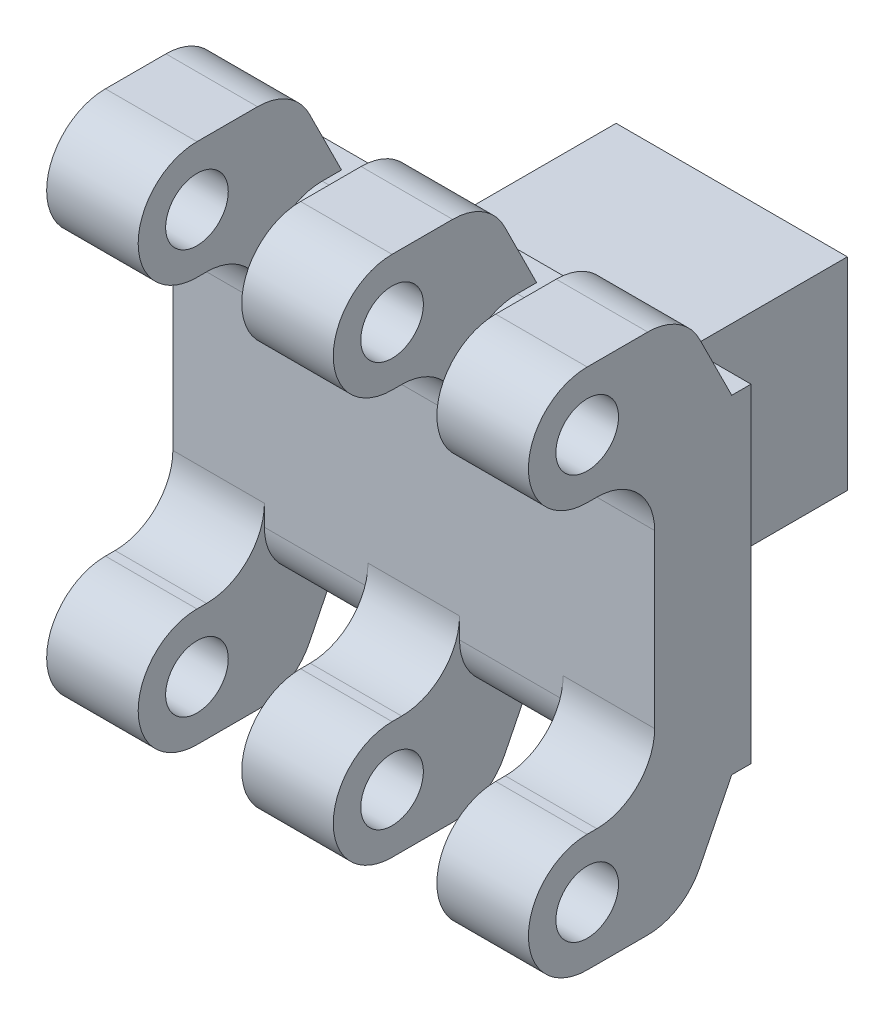
from build123d import *

# Parameters (mm, degrees)
SKETCH1_W               = 50
SKETCH1_H               = 34.11
BOSS_EXTRUDE1_DEPTH     = 10
SKETCH3_W               = 41
SKETCH3_H               = 21
BOSS_EXTRUDE2_DEPTH     = 3
CUT_EXTRUDE1_DEPTH      = 32.872763059
CUT_EXTRUDE1_DEPTH_BACK = 7
SKETCH2_W               = 3.5
SKETCH2_H               = 31
SKETCH4_W               = 25
SKETCH4_H               = 21
BOSS_EXTRUDE3_DEPTH     = 20
SKETCH5_R               = 8.6
CUT_EXTRUDE2_DEPTH      = 30
SKETCH6_R               = 3.25
BOSS_EXTRUDE4_DEPTH     = 9.5
LPATTERN1_COUNT         = 3
LPATTERN1_PITCH         = 20.25
MIRROR1_COPY_1_SKETCH_R = 3.25
MIRROR1_COPY_1_DEPTH    = 9.5
MIRROR1_COPY_2_SKETCH_R = 3.25
MIRROR1_COPY_2_DEPTH    = 9.5
FILLET1_R               = 6
SKETCH7_W               = 23
SKETCH7_H               = 21
CUT_EXTRUDE3_DEPTH      = 0.5
FILLET2_R               = 6


with BuildPart() as part:
    # Sketch1 → Boss-Extrude1 (new body)
    with BuildSketch(Plane.XY):
        Rectangle(SKETCH1_W, SKETCH1_H)
    extrude(amount=BOSS_EXTRUDE1_DEPTH)

    # Sketch3 → Boss-Extrude2 (add)
    with BuildSketch(Plane(origin=(0, 0, 0), x_dir=(-1, 0, 0), z_dir=(0, 0, -1))):
        Rectangle(SKETCH3_W, SKETCH3_H)
    extrude(amount=BOSS_EXTRUDE2_DEPTH)

    # Sketch2 → Cut-Extrude1 (cut, two sides: drawn at the far end of the back side and taken through both)
    with BuildSketch(Plane(origin=(0, 0, 0), x_dir=(-1, 0, 0), z_dir=(0, 0, -1)).offset(-CUT_EXTRUDE1_DEPTH_BACK)):
        with Locations((-14.25, 0)):
            Rectangle(SKETCH2_W, SKETCH2_H)
        with Locations((14.25, 0)):
            Rectangle(SKETCH2_W, SKETCH2_H)
    extrude(amount=CUT_EXTRUDE1_DEPTH + CUT_EXTRUDE1_DEPTH_BACK, mode=Mode.SUBTRACT)

    # Sketch4 → Boss-Extrude3 (add)
    with BuildSketch(Plane(origin=(0, 0, -3), x_dir=(-1, 0, 0), z_dir=(0, 0, -1))):
        Rectangle(SKETCH4_W, SKETCH4_H)
    extrude(amount=BOSS_EXTRUDE3_DEPTH)

    # Sketch5 → Cut-Extrude2 (cut)
    with BuildSketch(Plane(origin=(0, 0, -23), x_dir=(-1, 0, 0), z_dir=(0, 0, -1))):
        Circle(SKETCH5_R)
    extrude(amount=-CUT_EXTRUDE2_DEPTH, mode=Mode.SUBTRACT)

    # Sketch6 → Boss-Extrude4 (add)
    with BuildSketch(Plane(origin=(25, 0, 0), x_dir=(0, 0, -1), z_dir=(1, 0, 0))):
        with BuildLine():
            Line((-17, 27.1), (-7, 27.1))
            Line((-7, 27.1), (-2, 17.055))
            Line((-2, 17.055), (-10, 17.055))
            Line((-10, 17.055), (-10, 14.9))
            Line((-10, 14.9), (-17, 14.9))
            ThreePointArc((-17, 14.9), (-23.1, 21), (-17, 27.1))
        make_face()
        with Locations((-17, 21)):
            Circle(SKETCH6_R, mode=Mode.SUBTRACT)
    boss_extrude4 = extrude(amount=-BOSS_EXTRUDE4_DEPTH)

    # LPattern1: Boss-Extrude4 ×3
    with Locations(*[(-i * LPATTERN1_PITCH, 0, 0) for i in range(1, LPATTERN1_COUNT)]):
        add(boss_extrude4)

    # Mirror1: Boss-Extrude4 across plane
    add(boss_extrude4.mirror(Plane.ZX))

    # Mirror1 copy 1 sketch → Mirror1 copy 1 (add)
    with BuildSketch(Plane(origin=(4.75, 0, 0), x_dir=(0, 0, -1), z_dir=(1, 0, 0))):
        with BuildLine():
            Line((-17, -27.1), (-7, -27.1))
            Line((-7, -27.1), (-2, -17.055))
            Line((-2, -17.055), (-10, -17.055))
            Line((-10, -17.055), (-10, -14.9))
            Line((-10, -14.9), (-17, -14.9))
            ThreePointArc((-17, -14.9), (-23.1, -21), (-17, -27.1))
        make_face()
        with Locations((-17, -21)):
            Circle(MIRROR1_COPY_1_SKETCH_R, mode=Mode.SUBTRACT)
    extrude(amount=-MIRROR1_COPY_1_DEPTH)

    # Mirror1 copy 2 sketch → Mirror1 copy 2 (add)
    with BuildSketch(Plane(origin=(-15.5, 0, 0), x_dir=(0, 0, -1), z_dir=(1, 0, 0))):
        with BuildLine():
            Line((-17, -27.1), (-7, -27.1))
            Line((-7, -27.1), (-2, -17.055))
            Line((-2, -17.055), (-10, -17.055))
            Line((-10, -17.055), (-10, -14.9))
            Line((-10, -14.9), (-17, -14.9))
            ThreePointArc((-17, -14.9), (-23.1, -21), (-17, -27.1))
        make_face()
        with Locations((-17, -21)):
            Circle(MIRROR1_COPY_2_SKETCH_R, mode=Mode.SUBTRACT)
    extrude(amount=-MIRROR1_COPY_2_DEPTH)

    # Fillet1
    fillet1_edges = [part.edges().sort_by_distance(p)[0] for p in [
        (20.25, 27.1, 7),
        (20.25, 14.9, 10),
        (0, 27.1, 7),
        (0, 14.9, 10),
        (-20.25, 27.1, 7),
        (-20.25, 14.9, 10),
        (20.25, -14.9, 10),
        (20.25, -27.1, 7),
        (0, -14.9, 10),
        (0, -27.1, 7),
        (-20.25, -14.9, 10),
        (-20.25, -27.1, 7),
    ]]
    fillet(fillet1_edges, radius=FILLET1_R)

    # Sketch7 → Cut-Extrude3 (cut)
    with BuildSketch(Plane(origin=(12.5, 0, 0), x_dir=(0, 0, -1), z_dir=(1, 0, 0))):
        with Locations((11.5, 0)):
            Rectangle(SKETCH7_W, SKETCH7_H)
    cut_extrude3 = extrude(amount=-CUT_EXTRUDE3_DEPTH, mode=Mode.SUBTRACT)

    # Mirror2: Cut-Extrude3 across plane
    add(cut_extrude3.mirror(Plane(origin=(0, 0, 0), x_dir=(0, 0, 1), z_dir=(1, 0, 0))), mode=Mode.SUBTRACT)

    # Fillet2
    fillet2_edges = [part.edges().sort_by_distance(p)[0] for p in [
        (10.125, 17.055, 10),
        (-10.125, 17.055, 10),
        (10.125, -17.055, 10),
        (-10.125, -17.055, 10),
    ]]
    fillet(fillet2_edges, radius=FILLET2_R)


solid = part.part
